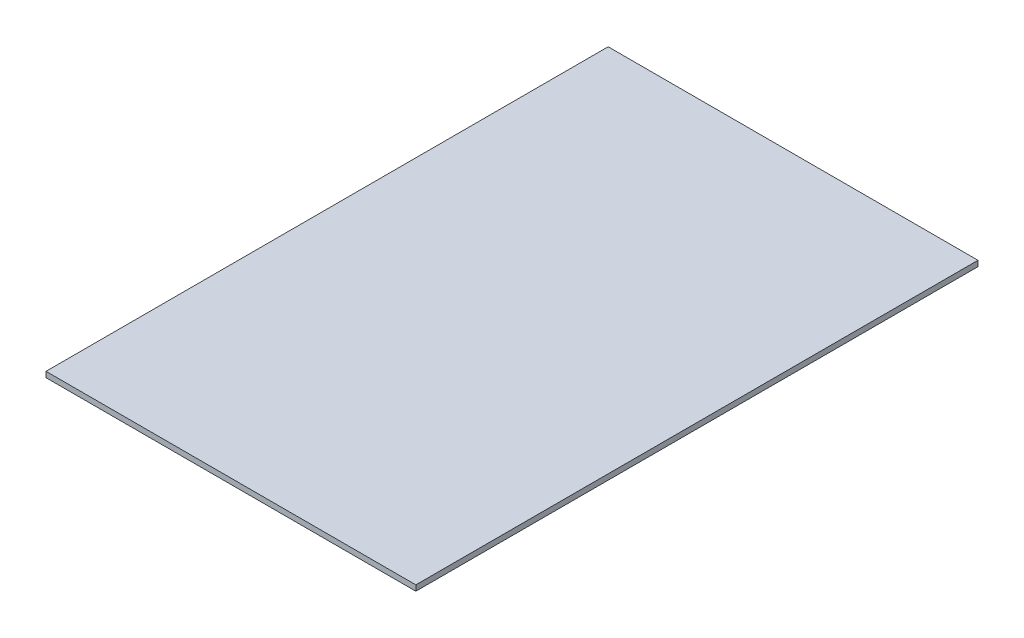
from build123d import *

# Parameters (mm, degrees)
SKETCH1_W           = 200
SKETCH1_H           = 304
BOSS_EXTRUDE1_DEPTH = 3


with BuildPart() as part:
    # Sketch1 → Boss-Extrude1 (new body)
    with BuildSketch(Plane(origin=(0, 0, 0), x_dir=(1, 0, 0), z_dir=(0, 1, 0))):
        with Locations((100, -152)):
            Rectangle(SKETCH1_W, SKETCH1_H)
    extrude(amount=BOSS_EXTRUDE1_DEPTH)


solid = part.part
